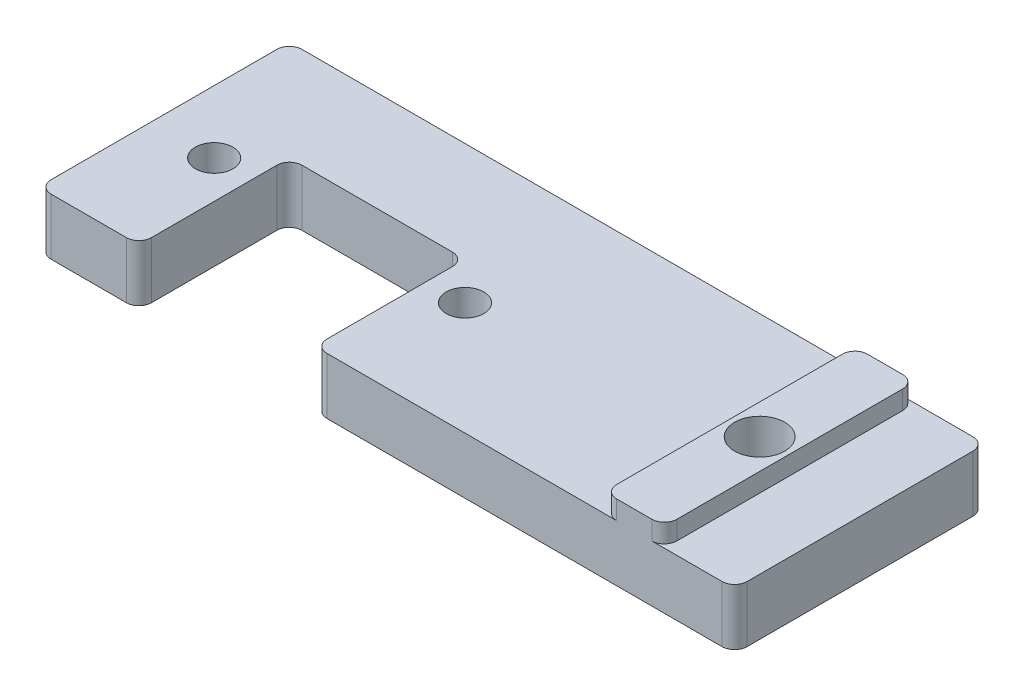
from build123d import *

# Parameters (mm, degrees)
ESQUISSE1_R             = 1.5
BOSS_EXTRU_1_DEPTH      = 4.5
CONG_1_R                = 1
ESQUISSE2_W             = 26.5
ESQUISSE2_H             = 20
BOSS_EXTRU_2_DEPTH      = 4.5
ESQUISSE3_W             = 4.8
ESQUISSE3_H             = 20
ESQUISSE3_R             = 2
BOSS_EXTRU_3_DEPTH      = 1.5
ESQUISSE4_R             = 2
ENL_V_MAT_EXTRU_1_DEPTH = 43.207819181
CONG_2_R                = 1


with BuildPart() as part:
    # Esquisse1 → Boss.-Extru.1 (new body)
    with BuildSketch(Plane(origin=(0, 0, 0), x_dir=(1, 0, 0), z_dir=(0, 1, 0))):
        Polygon((7, -9), (15, -9), (15, 11), (0, 11), (0, 3), (7, 3), align=None)
        with Locations(Location((10, 0, 0), (0, 0, 270))):
            Circle(ESQUISSE1_R, mode=Mode.SUBTRACT)
    extrude(amount=BOSS_EXTRU_1_DEPTH)

    # Congé1
    cong_1_edges = [part.edges().sort_by_distance(p)[0] for p in [
        (7, 2.25, -3),
        (15, 2.25, -11),
        (15, 2.25, 9),
        (7, 2.25, 9),
    ]]
    fillet(cong_1_edges, radius=CONG_1_R)

    # Symétrie1: part across plane


with BuildPart() as part_1:
    add(part.part)
    add(part.part.mirror(Plane(origin=(0, 4.5, -11), x_dir=(0, 0, 1), z_dir=(1, 0, 0))))

    # Esquisse2 → Boss.-Extru.2 (add)
    with BuildSketch(Plane(origin=(0, 4.5, 0), x_dir=(1, 0, 0), z_dir=(0, 1, 0))):
        with Locations((27.25, 1)):
            Rectangle(ESQUISSE2_W, ESQUISSE2_H)
    extrude(amount=-BOSS_EXTRU_2_DEPTH)

    # Esquisse3 → Boss.-Extru.3 (add)
    with BuildSketch(Plane.XZ.offset(-4.5)):
        with Locations((32.5, -1)):
            Rectangle(ESQUISSE3_W, ESQUISSE3_H)
        with Locations(Location((32.5, -1, 0), (0, 0, 270))):
            Circle(ESQUISSE3_R, mode=Mode.SUBTRACT)
    extrude(amount=-BOSS_EXTRU_3_DEPTH)

    # Esquisse4 → Enlèv. mat.-Extru.1 (cut, through all)
    with BuildSketch(Plane.XZ.offset(-4.5)):
        with Locations(Location((32.5, -1, 0), (0, 0, 270))):
            Circle(ESQUISSE4_R)
    extrude(amount=ENL_V_MAT_EXTRU_1_DEPTH, mode=Mode.SUBTRACT)

    # Congé2
    cong_2_edges = [part_1.edges().sort_by_distance(p)[0] for p in [
        (30.1, 5.25, 9),
        (30.1, 5.25, -11),
        (34.9, 5.25, -11),
        (34.9, 5.25, 9),
        (40.5, 2.25, -11),
        (40.5, 2.25, 9),
    ]]
    fillet(cong_2_edges, radius=CONG_2_R)


solid = part_1.part
